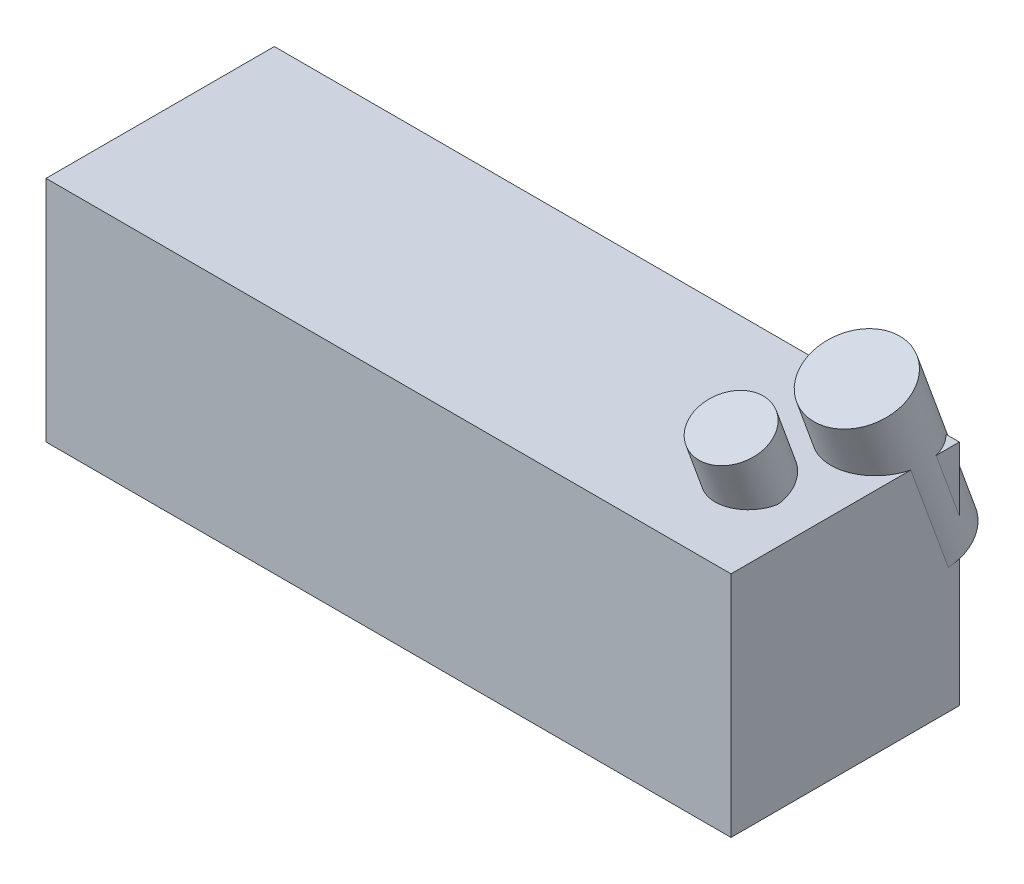
from build123d import *

# Parameters (mm, degrees)
SKETCH1_W           = 60
SKETCH1_H           = 20
BOSS_EXTRUDE1_DEPTH = 20
SKETCH5_R           = 4
BOSS_EXTRUDE5_DEPTH = 15
SKETCH4_R           = 3
BOSS_EXTRUDE4_DEPTH = 2.5


with BuildPart() as part:
    # Sketch1 → Boss-Extrude1 (new body)
    with BuildSketch(Plane.XY):
        with Locations((-29.998619437, 3.180300826)):
            Rectangle(SKETCH1_W, SKETCH1_H)
    extrude(amount=BOSS_EXTRUDE1_DEPTH)

    # Sketch5 → Boss-Extrude5 (add)
    with BuildSketch(Plane(origin=(0, 18.066374613, 6.5756226), x_dir=(-1, 0, 0), z_dir=(0, 0.9396926207859081, 0.34202014332566943))):
        with Locations(Location((3.860358384, -1.55145078, 0), (0, 0, 90))):
            Circle(SKETCH5_R)
    extrude(amount=-BOSS_EXTRUDE5_DEPTH)


with BuildPart() as body_2:
    # Sketch4 → Boss-Extrude4 (new, symmetric)
    with BuildSketch(Plane(origin=(0, 18.066374613, 6.5756226), x_dir=(-1, 0, 0), z_dir=(0, 0.9396926207859081, 0.34202014332566943))):
        with Locations(Location((6.148675579, 6.819695783, 0), (0, 0, 90))):
            Circle(SKETCH4_R)
    extrude(amount=BOSS_EXTRUDE4_DEPTH, both=True)


solid = Compound([part.part, body_2.part])
